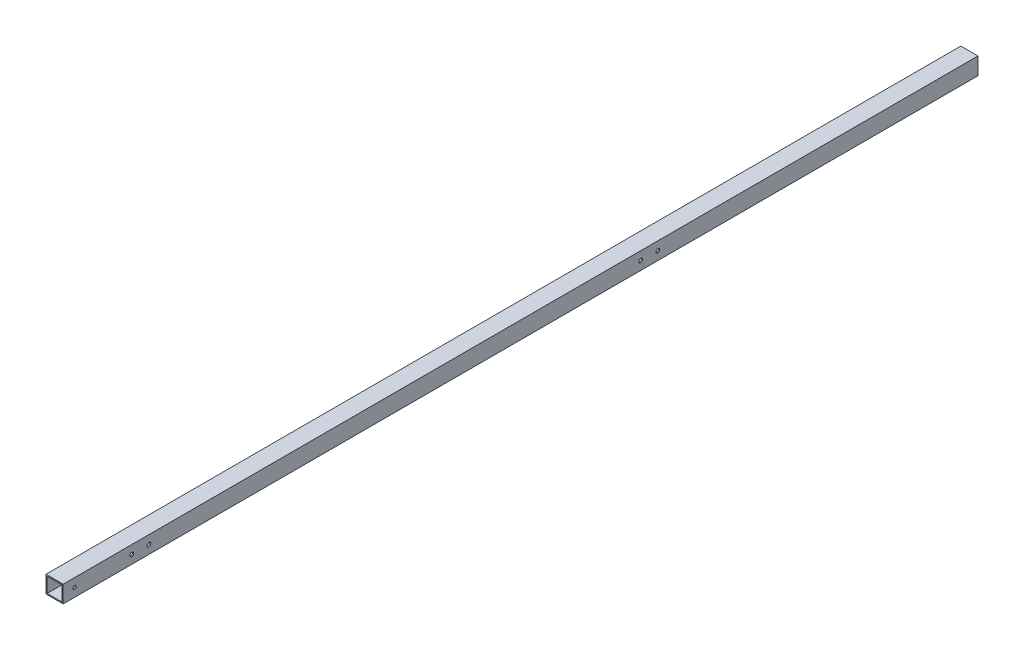
from build123d import *

# Parameters (mm, degrees)
SKETCH_1_W          = 15
SKETCH_1_H          = 15
SKETCH_1_W_2        = 13
SKETCH_1_H_2        = 13
EXTRUDE_1_DEPTH     = 800
SKETCH_4_R          = 1.5
CUT_EXTRUDE_3_DEPTH = 801.281200579
SKETCH_5_R          = 1.65
CUT_EXTRUDE_4_DEPTH = 801.281200579


with BuildPart() as part:
    # 草图1 → 拉伸-薄壁1 (new body)
    with BuildSketch(Plane.XY):
        with Locations((7.5, -7.5)):
            Rectangle(SKETCH_1_W, SKETCH_1_H)
        with Locations((7.5, -7.5)):
            Rectangle(SKETCH_1_W_2, SKETCH_1_H_2, mode=Mode.SUBTRACT)
    extrude(amount=EXTRUDE_1_DEPTH)

    # 草图4 → 切除-拉伸3 (cut, through all)
    with BuildSketch(Plane(origin=(15, 0, 0), x_dir=(0, 0, -1), z_dir=(1, 0, 0))):
        with Locations(Location((-790, -7.5, 0), (0, 0, 90))):
            Circle(SKETCH_4_R)
    extrude(amount=-CUT_EXTRUDE_3_DEPTH, mode=Mode.SUBTRACT)

    # 草图5 → 切除-拉伸4 (cut, through all)
    with BuildSketch(Plane(origin=(15, 0, 0), x_dir=(0, 0, -1), z_dir=(1, 0, 0))):
        with Locations(Location((-280, -7.5, 0), (0, 0, 90))):
            Circle(SKETCH_5_R)
        with Locations(Location((-295, -7.5, 0), (0, 0, 90))):
            Circle(SKETCH_5_R)
        with Locations(Location((-725, -7.5, 0), (0, 0, 90))):
            Circle(SKETCH_5_R)
        with Locations(Location((-740, -7.5, 0), (0, 0, 90))):
            Circle(SKETCH_5_R)
    extrude(amount=-CUT_EXTRUDE_4_DEPTH, mode=Mode.SUBTRACT)


solid = part.part
